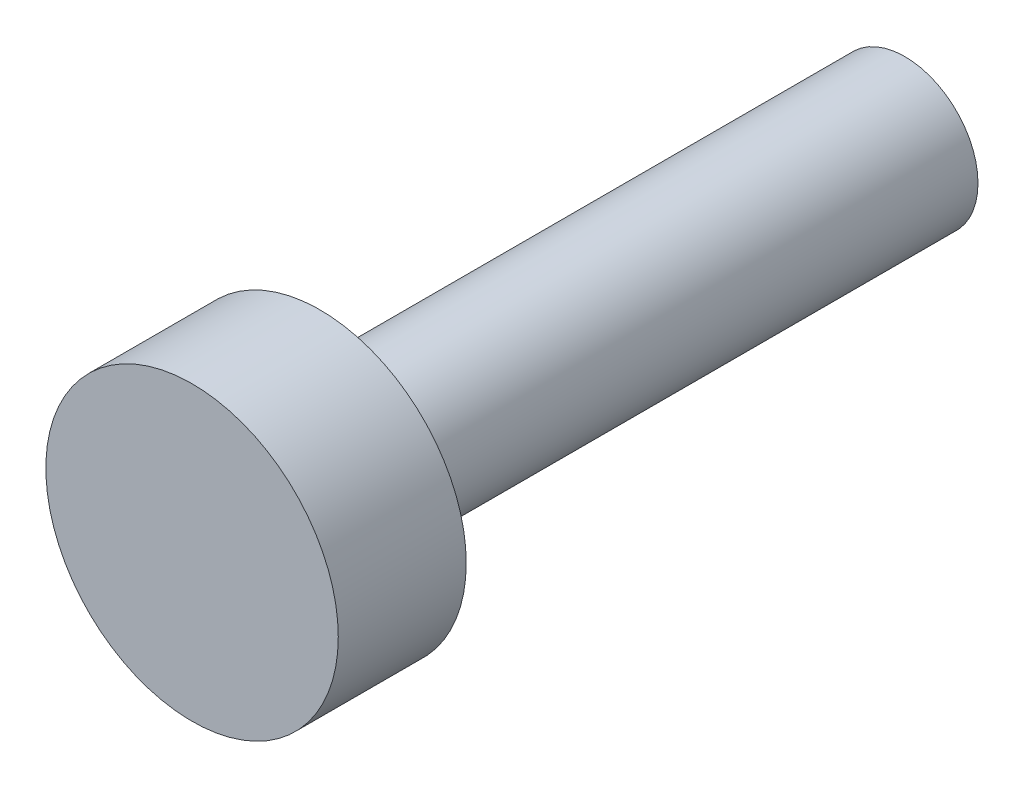
from build123d import *

# Parameters (mm, degrees)
SKETCH_1_R      = 2
EXTRUDE_1_DEPTH = 16
SKETCH_2_R      = 4
EXTRUDE_2_DEPTH = 3.5


with BuildPart() as part:
    # Эскиз1 → Бобышка-Вытянуть1 (new body)
    with BuildSketch(Plane.XY):
        Circle(SKETCH_1_R)
    extrude(amount=EXTRUDE_1_DEPTH)

    # Эскиз2 → Бобышка-Вытянуть2 (add)
    with BuildSketch(Plane.XY.offset(16)):
        Circle(SKETCH_2_R)
    extrude(amount=EXTRUDE_2_DEPTH)


solid = part.part
